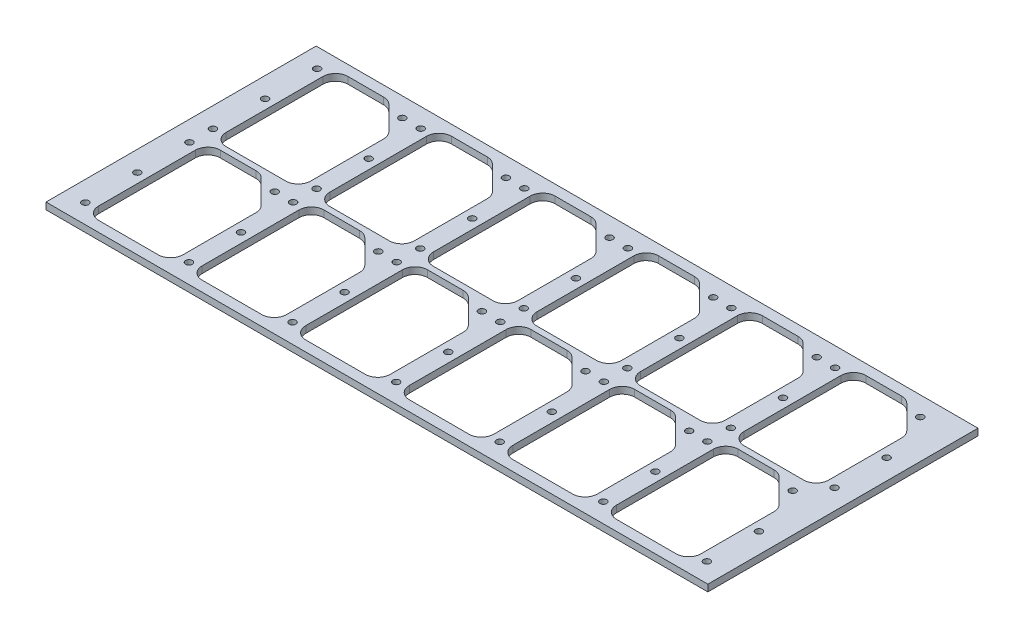
from build123d import *

# Parameters (mm, degrees)
SKETCH1_W            = 622.3
SKETCH1_H            = 254
BOSS_EXTRUDE1_DEPTH  = 6.35
CUT_EXTRUDE1_DEPTH   = 337.130398804
LPATTERN1_COUNT      = 6
LPATTERN1_PITCH      = 97.4
LPATTERN1_COUNT_DIR2 = 2
LPATTERN1_PITCH_DIR2 = 120
SKETCH3_R            = 3.175
CUT_EXTRUDE2_DEPTH   = 337.130398804
LPATTERN2_COUNT      = 6
LPATTERN2_PITCH      = 97.4
LPATTERN2_COUNT_DIR2 = 2
LPATTERN2_PITCH_DIR2 = 120


with BuildPart() as part:
    # Sketch1 → Boss-Extrude1 (new body)
    with BuildSketch(Plane(origin=(0, 0, 0), x_dir=(1, 0, 0), z_dir=(0, 1, 0))):
        Rectangle(SKETCH1_W, SKETCH1_H)
    extrude(amount=BOSS_EXTRUDE1_DEPTH)

    # Sketch2 → Cut-Extrude1 (cut, through all)
    with BuildSketch(Plane(origin=(0, 6.35, 0), x_dir=(1, 0, 0), z_dir=(0, 1, 0))):
        with BuildLine():
            Line((-207.22685066, -28.590811691), (-229.590811691, -6.22685066))
            ThreePointArc((-229.590811691, -6.22685066), (-233.386564872, -3.69060947), (-237.863961031, -2.8))
            Line((-237.863961031, -2.8), (-271.5, -2.8))
            ThreePointArc((-271.5, -2.8), (-279.77314934, -6.22685066), (-283.2, -14.5))
            Line((-283.2, -14.5), (-283.2, -105.5))
            ThreePointArc((-283.2, -105.5), (-279.77314934, -113.77314934), (-271.5, -117.2))
            Line((-271.5, -117.2), (-215.5, -117.2))
            ThreePointArc((-215.5, -117.2), (-207.22685066, -113.77314934), (-203.8, -105.5))
            Line((-203.8, -105.5), (-203.8, -36.863961031))
            ThreePointArc((-203.8, -36.863961031), (-204.69060947, -32.386564872), (-207.22685066, -28.590811691))
        make_face()
    cut_extrude1 = extrude(amount=-CUT_EXTRUDE1_DEPTH, mode=Mode.SUBTRACT)

    # LPattern1: Cut-Extrude1 6 × 2
    with Locations(*[(i * LPATTERN1_PITCH, 0, -j * LPATTERN1_PITCH_DIR2) for i in range(LPATTERN1_COUNT) for j in range(LPATTERN1_COUNT_DIR2) if (i, j) != (0, 0)]):
        add(cut_extrude1, mode=Mode.SUBTRACT)

    # Sketch3 → Cut-Extrude2 (cut, through all)
    with BuildSketch(Plane(origin=(0, 6.35, 0), x_dir=(1, 0, 0), z_dir=(0, 1, 0))):
        with Locations(Location((-292.2, 108.955129855, 0), (0, 0, 270))):
            Circle(SKETCH3_R)
        with Locations(Location((-292.2, 11.044870145, 0), (0, 0, 270))):
            Circle(SKETCH3_R)
        with Locations(Location((-212.044870145, 108.955129855, 0), (0, 0, 270))):
            Circle(SKETCH3_R)
        with Locations(Location((-292.2, 60, 0), (0, 0, 270))):
            Circle(SKETCH3_R)
        with Locations(Location((-194.8, 60, 0), (0, 0, 270))):
            Circle(SKETCH3_R)
        with Locations(Location((-194.8, 11.044870145, 0), (0, 0, 270))):
            Circle(SKETCH3_R)
    cut_extrude2 = extrude(amount=-CUT_EXTRUDE2_DEPTH, mode=Mode.SUBTRACT)

    # LPattern2: Cut-Extrude2 6 × 2
    with Locations(*[(i * LPATTERN2_PITCH, 0, j * LPATTERN2_PITCH_DIR2) for i in range(LPATTERN2_COUNT) for j in range(LPATTERN2_COUNT_DIR2) if (i, j) != (0, 0)]):
        add(cut_extrude2, mode=Mode.SUBTRACT)


solid = part.part
